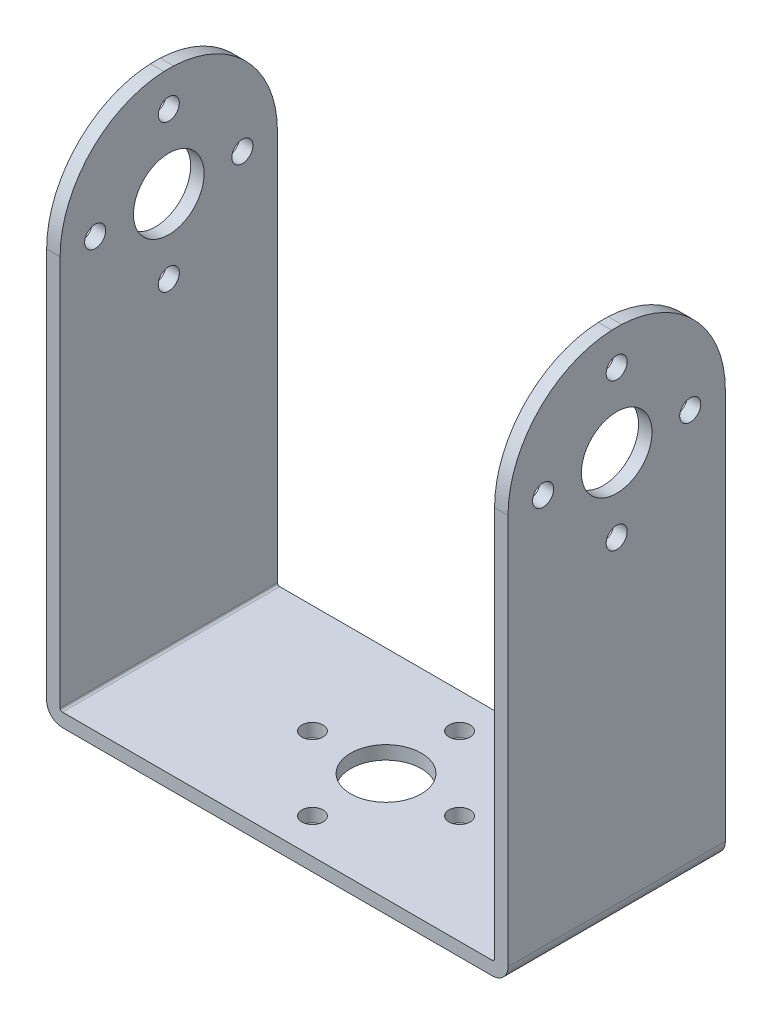
from build123d import *

# Parameters (mm, degrees)
SKETCH1_W               = 49.1998
SKETCH1_H               = 24.6126
SKETCH1_R               = 1.1938
SKETCH1_R_2             = 4.0005
EXTRUDE1_DEPTH          = 1.524
SKETCH1_3_W             = 1.524
SKETCH1_3_H             = 24.6126
EXTRUDE2_DEPTH          = 58.3438
CUT_EXTRUDE1_DEPTH      = 40.8686
CUT_EXTRUDE1_DEPTH_BACK = 40.8686
SKETCH4_R               = 4.0005
SKETCH4_R_2             = 1.1938
FILLET1_R               = 0.254
FILLET2_R               = 1.778


with BuildPart() as part:
    # Sketch1 → Extrude1 (new body)
    with BuildSketch(Plane(origin=(0, 0, 0), x_dir=(1, 0, 0), z_dir=(0, 1, 0))):
        Rectangle(SKETCH1_W, SKETCH1_H)
        with Locations(Location((-8.3312, 0, 0), (0, 0, 90))):
            Circle(SKETCH1_R, mode=Mode.SUBTRACT)
        with Locations(Location((0, -8.3312, 0), (0, 0, 90))):
            Circle(SKETCH1_R, mode=Mode.SUBTRACT)
        with Locations(Location((0, 0, 0), (0, 0, 90))):
            Circle(SKETCH1_R_2, mode=Mode.SUBTRACT)
        with Locations(Location((8.3312, 0, 0), (0, 0, 90))):
            Circle(SKETCH1_R, mode=Mode.SUBTRACT)
        with Locations(Location((0, 8.3312, 0), (0, 0, 90))):
            Circle(SKETCH1_R, mode=Mode.SUBTRACT)
    extrude(amount=EXTRUDE1_DEPTH)

    # Sketch1<3> → Extrude2 (add)
    with BuildSketch(Plane(origin=(0, 0, 0), x_dir=(1, 0, 0), z_dir=(0, 1, 0))):
        with Locations((25.3619, 0)):
            Rectangle(SKETCH1_3_W, SKETCH1_3_H)
        with Locations((-25.3619, 0)):
            Rectangle(SKETCH1_3_W, SKETCH1_3_H)
    extrude(amount=EXTRUDE2_DEPTH)

    # Sketch4 → Cut-Extrude1 (cut, two sides: drawn at the far end of the back side and taken through both)
    with BuildSketch(Plane(origin=(0, 0, 0), x_dir=(0, 0, -1), z_dir=(1, 0, 0)).offset(-CUT_EXTRUDE1_DEPTH_BACK)):
        with BuildLine():
            Line((-0.5589443, 58.3438), (-12.3063, 58.3438))
            Line((-12.3063, 58.3438), (-12.3063, 46.0502))
            ThreePointArc((-12.3063, 46.0502), (-8.897290484, 54.552155171), (-0.5589443, 58.3438))
        make_face()
        with BuildLine():
            Line((12.3063, 58.3438), (0.5589443, 58.3438))
            ThreePointArc((0.5589443, 58.3438), (8.897290484, 54.552155171), (12.3063, 46.0502))
            Line((12.3063, 46.0502), (12.3063, 58.3438))
        make_face()
        with Locations((0, 46.0629)):
            Circle(SKETCH4_R)
        with Locations((8.3312, 46.0629)):
            Circle(SKETCH4_R_2)
        with Locations((0, 54.3941)):
            Circle(SKETCH4_R_2)
        with Locations((-8.3312, 46.0629)):
            Circle(SKETCH4_R_2)
        with Locations((0, 37.7317)):
            Circle(SKETCH4_R_2)
    extrude(amount=CUT_EXTRUDE1_DEPTH + CUT_EXTRUDE1_DEPTH_BACK, mode=Mode.SUBTRACT)

    # Fillet1
    fillet1_edges = [part.edges().sort_by_distance(p)[0] for p in [
        (-24.5999, 1.524, 0),
        (24.5999, 1.524, 0),
    ]]
    fillet(fillet1_edges, radius=FILLET1_R)

    # Fillet2
    fillet2_edges = [part.edges().sort_by_distance(p)[0] for p in [
        (-26.1239, 0, 0),
        (26.1239, 0, 0),
    ]]
    fillet(fillet2_edges, radius=FILLET2_R)


solid = part.part
